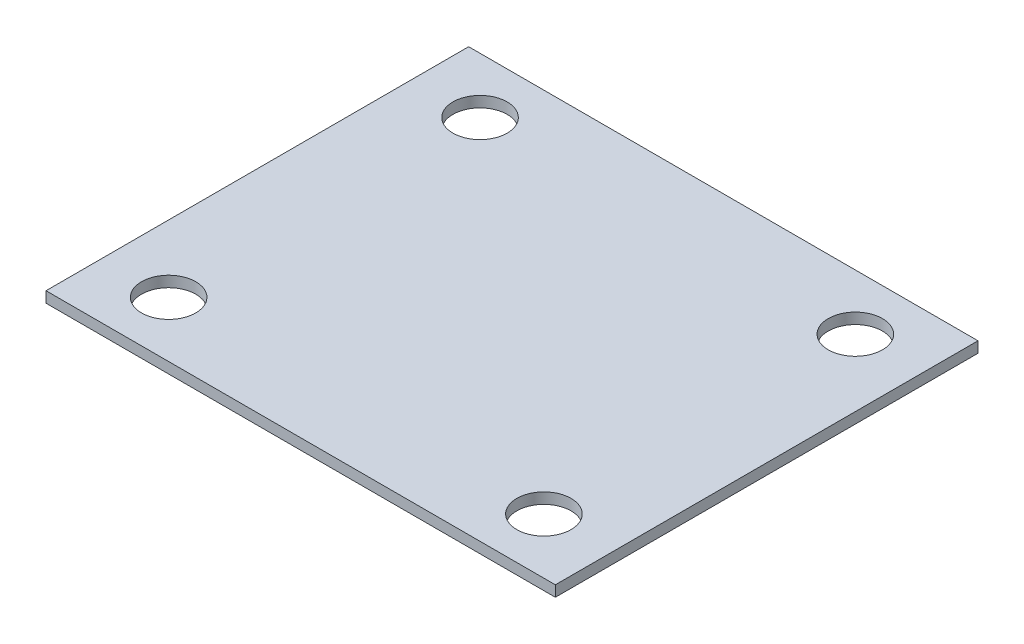
from build123d import *

# Parameters (mm, degrees)
SKETCH1_W           = 47
SKETCH1_H           = 39
BOSS_EXTRUDE1_DEPTH = 1
SKETCH2_R           = 2.5
CUT_EXTRUDE1_DEPTH  = 31.553232235


with BuildPart() as part:
    # Sketch1 → Boss-Extrude1 (new body)
    with BuildSketch(Plane(origin=(0, 0, 0), x_dir=(1, 0, 0), z_dir=(0, 1, 0))):
        Rectangle(SKETCH1_W, SKETCH1_H)
    extrude(amount=BOSS_EXTRUDE1_DEPTH)

    # Sketch2 → Cut-Extrude1 (cut, through all)
    with BuildSketch(Plane(origin=(0, 1, 0), x_dir=(1, 0, 0), z_dir=(0, 1, 0))):
        with Locations(Location((-17.315138118, 14.367880566, 0), (0, 0, 270))):
            Circle(SKETCH2_R)
        with Locations(Location((17.315138118, -14.367880566, 0), (0, 0, 270))):
            Circle(SKETCH2_R)
        with Locations(Location((17.315138118, 14.367880566, 0), (0, 0, 270))):
            Circle(SKETCH2_R)
        with Locations(Location((-17.315138118, -14.367880566, 0), (0, 0, 270))):
            Circle(SKETCH2_R)
    extrude(amount=-CUT_EXTRUDE1_DEPTH, mode=Mode.SUBTRACT)


solid = part.part
